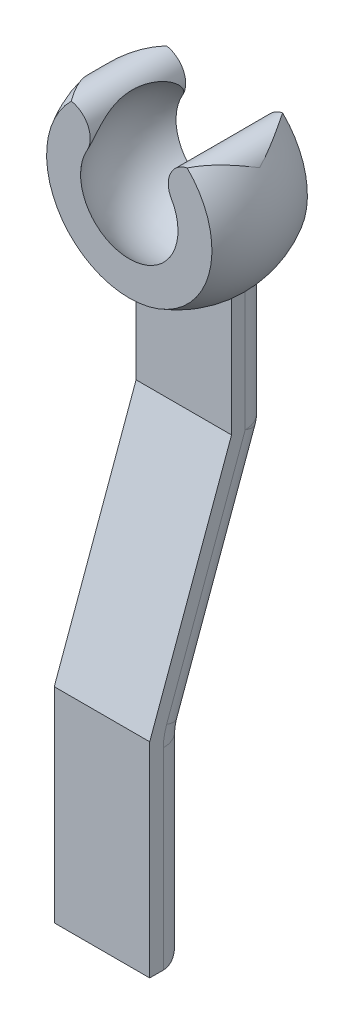
from build123d import *

# Parameters (mm, degrees)
BOSS_EXTRUDE1_DEPTH = 3.5
CUT_EXTRUDE1_DEPTH  = 55.39329676
FILLET10_R          = 2


with BuildPart() as part:
    # Sketch1 → Boss-Extrude1 (new, symmetric)
    with BuildSketch(Plane(origin=(0, 0, 0), x_dir=(0, 0, -1), z_dir=(1, 0, 0))):
        Polygon((0, 0), (0, 15), (6, 31.484864517), (6, 46.484864517), (9, 46.484864517), (9, 30.955883575), (3, 14.471019058), (3, 0), align=None)
    extrude(amount=BOSS_EXTRUDE1_DEPTH, both=True)

    # Sketch2 → Revolve1 (revolve)
    with BuildSketch(Plane(origin=(0, 46.484864517, 0), x_dir=(1, 0, 0), z_dir=(0, 1, 0))):
        with BuildLine():
            Line((0, 2), (0, 9))
            Line((0, 9), (6.062177826, 9))
            ThreePointArc((6.062177826, 9), (7, 5.5), (6.062177826, 2))
            Line((6.062177826, 2), (0, 2))
        make_face()
    revolve(axis=Axis((0, 46.484864517, -2), (0, 0, -1)))

    # Sketch3 → Cut-Revolve1 (revolve, cut)
    with BuildSketch(Plane(origin=(0, 0, 0), x_dir=(0, 0, -1), z_dir=(1, 0, 0))):
        with BuildLine():
            Line((2, 46.484864517), (9, 46.484864517))
            Line((9, 46.484864517), (9, 42.914150302))
            ThreePointArc((9, 42.914150302), (5.5, 41.484864517), (2, 42.914150302))
            Line((2, 42.914150302), (2, 46.484864517))
        make_face()
    revolve(axis=Axis((0, 46.484864517, -2), (0, 0, -1)), mode=Mode.SUBTRACT)

    # Sketch4 → Cut-Extrude1 (cut, through all)
    with BuildSketch(Plane.XY.offset(-2)):
        with BuildLine():
            ThreePointArc((-3.092329219, 48.270221624), (-3.719932076, 50.612467374), (-6.062177826, 49.984864517))
            ThreePointArc((-6.062177826, 49.984864517), (0, 53.484864517), (6.062177826, 49.984864517))
            ThreePointArc((6.062177826, 49.984864517), (3.719932076, 50.612467374), (3.092329219, 48.270221624))
            ThreePointArc((3.092329219, 48.270221624), (0, 50.055578731), (-3.092329219, 48.270221624))
        make_face()
    extrude(amount=-CUT_EXTRUDE1_DEPTH, mode=Mode.SUBTRACT)

    # Fillet10
    fillet10_edges = [part.edges().sort_by_distance(p)[0] for p in [
        (-3.5, 36.245500312, -9),
        (-3.5, 22.713451316, -6),
        (-3.5, 7.235509529, -3),
        (3.5, 22.713451316, -6),
        (0, 30.955883575, -9),
        (0, 14.471019058, -3),
        (0, 0, -3),
        (3.5, 36.245500312, -9),
        (3.5, 7.235509529, -3),
    ]]
    fillet(fillet10_edges, radius=FILLET10_R)


solid = part.part
